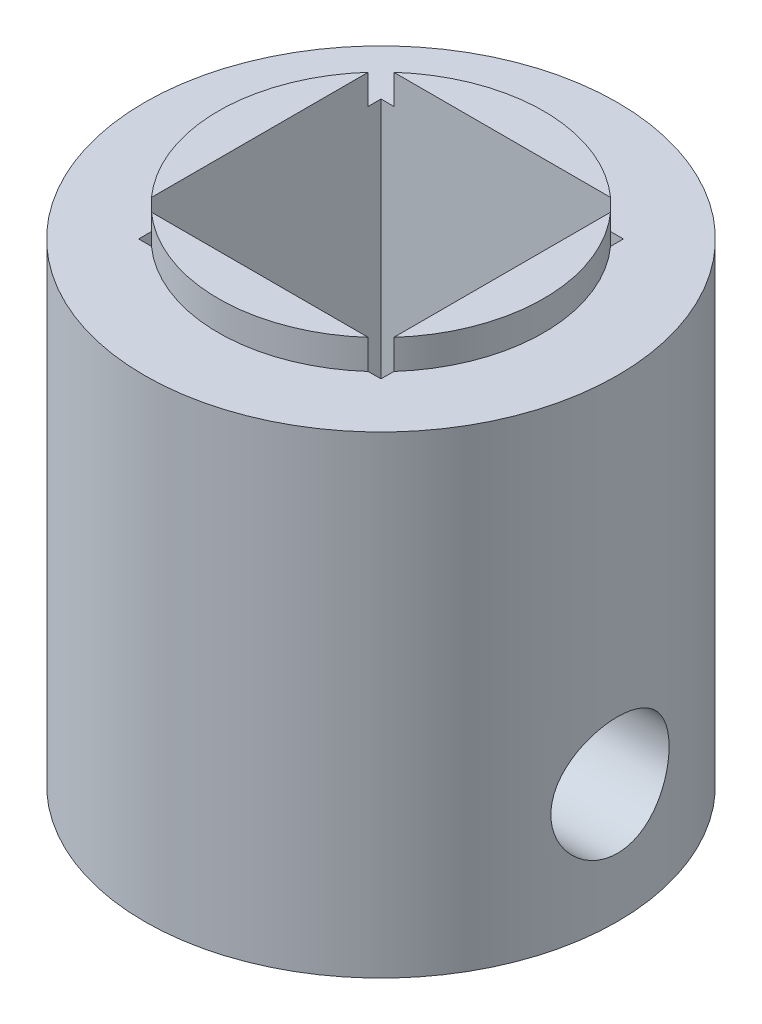
from build123d import *

# Parameters (mm, degrees)
SKETCH1_R           = 5.5
BOSS_EXTRUDE1_DEPTH = 1
SKETCH2_R           = 8
BOSS_EXTRUDE2_DEPTH = 16
SKETCH3_W           = 8.2
SKETCH3_H           = 8.2
CUT_EXTRUDE1_DEPTH  = 21.420577857
SKETCH4_R           = 2
CUT_EXTRUDE2_DEPTH  = 25


with BuildPart() as part:
    # Sketch1 → Boss-Extrude1 (new body)
    with BuildSketch(Plane(origin=(0, 0, 0), x_dir=(1, 0, 0), z_dir=(0, 1, 0))):
        with Locations(Location((0, 0, 0), (0, 0, 270))):
            Circle(SKETCH1_R)
    extrude(amount=BOSS_EXTRUDE1_DEPTH)

    # Sketch2 → Boss-Extrude2 (add)
    with BuildSketch(Plane(origin=(0, 0, 0), x_dir=(-1, 0, 0), z_dir=(0, -1, 0))):
        with Locations(Location((0, 0, 0), (0, 0, 90))):
            Circle(SKETCH2_R)
    extrude(amount=BOSS_EXTRUDE2_DEPTH)

    # Sketch3 → Cut-Extrude1 (cut, through all)
    with BuildSketch(Plane.XZ.offset(16)):
        Rectangle(SKETCH3_W, SKETCH3_H)
    extrude(amount=-CUT_EXTRUDE1_DEPTH, mode=Mode.SUBTRACT)

    # Sketch4 → Cut-Extrude2 (cut, through all)
    with BuildSketch(Plane.ZY.offset(8)):
        with Locations(Location((0, -12, 0), (0, 0, 90))):
            Circle(SKETCH4_R)
    extrude(amount=-CUT_EXTRUDE2_DEPTH, mode=Mode.SUBTRACT)


solid = part.part
